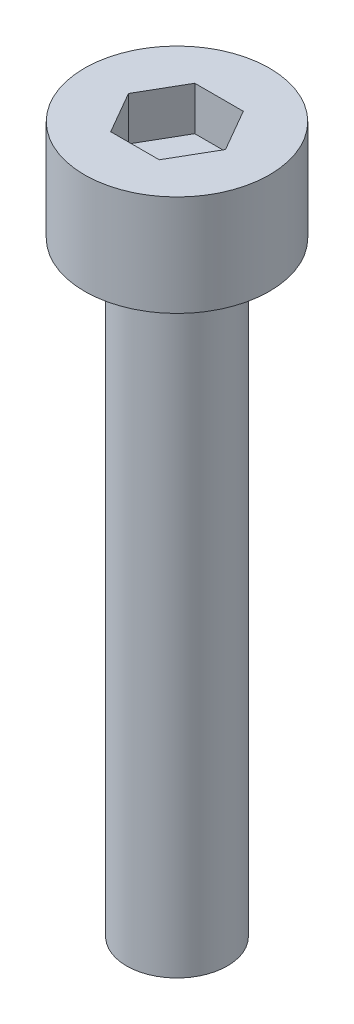
from build123d import *

# Parameters (mm, degrees)
SKETCH_1_R          = 2.75
EXTRUDE_399_DEPTH   = 3
SKETCH_1_3_R        = 1.5
EXTRUDE_434_DEPTH   = 18
CUT_EXTRUDE_1_DEPTH = 1.3


with BuildPart() as part:
    # 草图1 → Extrude 399 (new body)
    with BuildSketch(Plane(origin=(0, 0, 0), x_dir=(1, 0, 0), z_dir=(0, 1, 0))):
        Circle(SKETCH_1_R)
    extrude(amount=EXTRUDE_399_DEPTH)

    # 草图1<3> → Extrude 434 (add)
    with BuildSketch(Plane(origin=(0, 0, 0), x_dir=(1, 0, 0), z_dir=(0, 1, 0))):
        Circle(SKETCH_1_3_R)
    extrude(amount=-EXTRUDE_434_DEPTH)

    # 草图2 → 切除-拉伸1 (cut)
    with BuildSketch(Plane(origin=(0, 3, 0), x_dir=(1, 0, 0), z_dir=(0, 1, 0))):
        Polygon((1.443375673, 0), (0.721687836, 1.25), (-0.721687836, 1.25), (-1.443375673, 0), (-0.721687836, -1.25), (0.721687836, -1.25), align=None)
    extrude(amount=-CUT_EXTRUDE_1_DEPTH, mode=Mode.SUBTRACT)


solid = part.part
